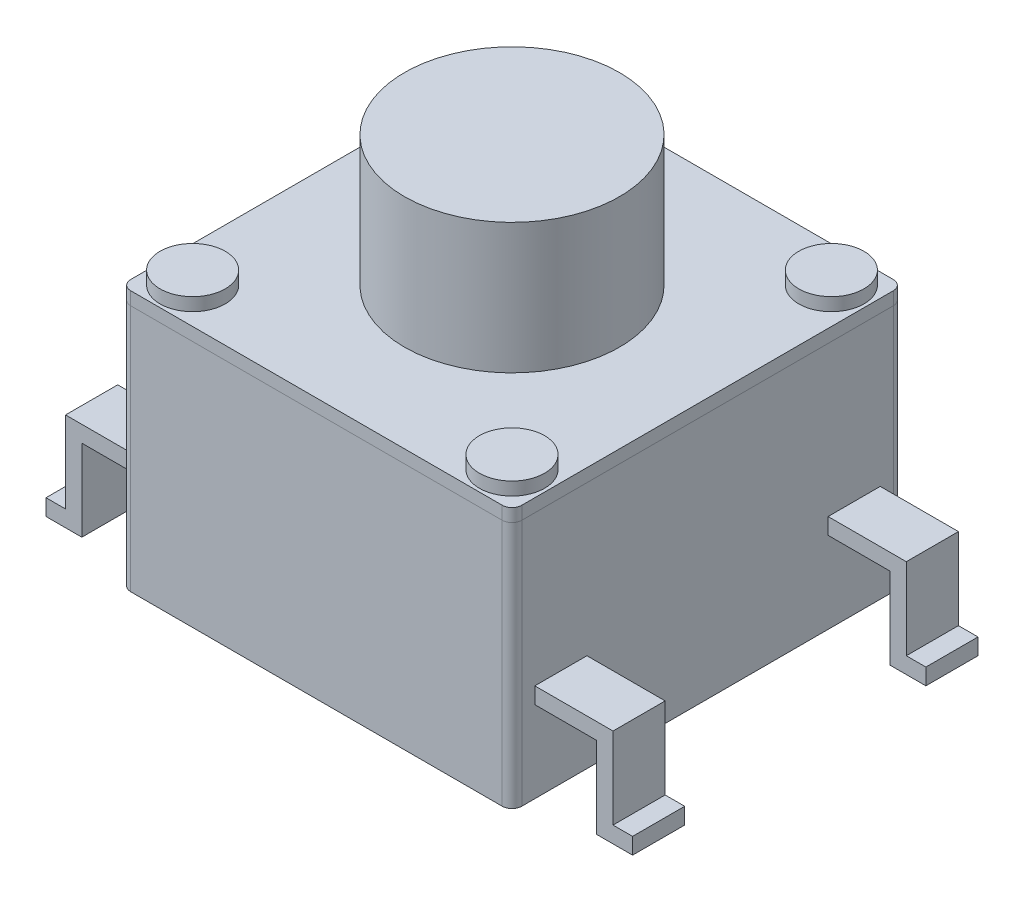
from build123d import *

# Parameters (mm, degrees)
SKETCH1_W           = 6
SKETCH1_H           = 6
BOSS_EXTRUDE1_DEPTH = 3.8
SKETCH1_3_R         = 1.65
BOSS_EXTRUDE2_DEPTH = 6
SKETCH1_4_R         = 0.5
BOSS_EXTRUDE3_DEPTH = 4.2
SKETCH2_W           = 6
SKETCH2_H           = 6
SKETCH2_R           = 1.65
SKETCH2_R_2         = 0.5
BOSS_EXTRUDE4_DEPTH = 0.2
FILLET1_R           = 0.15
FILLET2_R           = 0.15
BOSS_EXTRUDE5_START = -0.75
BOSS_EXTRUDE5_DEPTH = 0.4
BOSS_EXTRUDE6_START = -5.25
BOSS_EXTRUDE6_DEPTH = 0.4


with BuildPart() as part:
    # Sketch1 → Boss-Extrude1 (new body)
    with BuildSketch(Plane(origin=(0, 0, 0), x_dir=(1, 0, 0), z_dir=(0, 1, 0))):
        with Locations((3, 3)):
            Rectangle(SKETCH1_W, SKETCH1_H)
    extrude(amount=BOSS_EXTRUDE1_DEPTH)

    # Sketch1<3> → Boss-Extrude2 (add)
    with BuildSketch(Plane(origin=(0, 0, 0), x_dir=(1, 0, 0), z_dir=(0, 1, 0))):
        with Locations((3, 3)):
            Circle(SKETCH1_3_R)
    extrude(amount=BOSS_EXTRUDE2_DEPTH)

    # Sketch1<4> → Boss-Extrude3 (add)
    with BuildSketch(Plane(origin=(0, 0, 0), x_dir=(1, 0, 0), z_dir=(0, 1, 0))):
        with Locations((0.55, 5.45)):
            Circle(SKETCH1_4_R)
        with Locations((5.45, 5.45)):
            Circle(SKETCH1_4_R)
        with Locations((5.45, 0.55)):
            Circle(SKETCH1_4_R)
        with Locations((0.55, 0.55)):
            Circle(SKETCH1_4_R)
    extrude(amount=BOSS_EXTRUDE3_DEPTH)

    # Fillet1
    fillet1_edges = [part.edges().sort_by_distance(p)[0] for p in [
        (0, 1.9, 0),
        (0, 1.9, -6),
        (6, 1.9, -6),
        (6, 1.9, 0),
    ]]
    fillet(fillet1_edges, radius=FILLET1_R)

    # Sketch3 → Boss-Extrude5 (add, symmetric)
    with BuildSketch(Plane(origin=(0, 0, -6), x_dir=(-1, 0, 0), z_dir=(0, 0, -1)).offset(BOSS_EXTRUDE5_START)):
        Polygon((-6, 1.25), (-6.95, 1.25), (-6.95, 0), (-7.5, 0), (-7.5, 0.25), (-7.2, 0.25), (-7.2, 1.5), (-6, 1.5), align=None)
    boss_extrude5 = extrude(amount=BOSS_EXTRUDE5_DEPTH, both=True)

    # Sketch3<2> → Boss-Extrude6 (add, symmetric)
    with BuildSketch(Plane(origin=(0, 0, -6), x_dir=(-1, 0, 0), z_dir=(0, 0, -1)).offset(BOSS_EXTRUDE6_START)):
        Polygon((-6, 1.25), (-6.95, 1.25), (-6.95, 0), (-7.5, 0), (-7.5, 0.25), (-7.2, 0.25), (-7.2, 1.5), (-6, 1.5), align=None)
    boss_extrude6 = extrude(amount=BOSS_EXTRUDE6_DEPTH, both=True)

    # Mirror1: Boss-Extrude5, Boss-Extrude6 across plane
    add(boss_extrude5.mirror(Plane(origin=(3, 0, 0), x_dir=(0, 0, 1), z_dir=(1, 0, 0))))
    add(boss_extrude6.mirror(Plane(origin=(3, 0, 0), x_dir=(0, 0, 1), z_dir=(1, 0, 0))))


with BuildPart() as body_2:
    # Sketch2 → Boss-Extrude4 (new body)
    with BuildSketch(Plane(origin=(0, 3.8, 0), x_dir=(1, 0, 0), z_dir=(0, 1, 0))):
        with Locations((3, 3)):
            Rectangle(SKETCH2_W, SKETCH2_H)
        with Locations((3, 3)):
            Circle(SKETCH2_R, mode=Mode.SUBTRACT)
        with Locations((5.45, 0.55)):
            Circle(SKETCH2_R_2, mode=Mode.SUBTRACT)
        with Locations((0.55, 0.55)):
            Circle(SKETCH2_R_2, mode=Mode.SUBTRACT)
        with Locations((0.55, 5.45)):
            Circle(SKETCH2_R_2, mode=Mode.SUBTRACT)
        with Locations((5.45, 5.45)):
            Circle(SKETCH2_R_2, mode=Mode.SUBTRACT)
    extrude(amount=BOSS_EXTRUDE4_DEPTH)

    # Fillet2
    fillet2_edges = [body_2.edges().sort_by_distance(p)[0] for p in [
        (6, 3.9, -6),
        (6, 3.9, 0),
        (0, 3.9, 0),
        (0, 3.9, -6),
    ]]
    fillet(fillet2_edges, radius=FILLET2_R)


solid = Compound([part.part, body_2.part])
